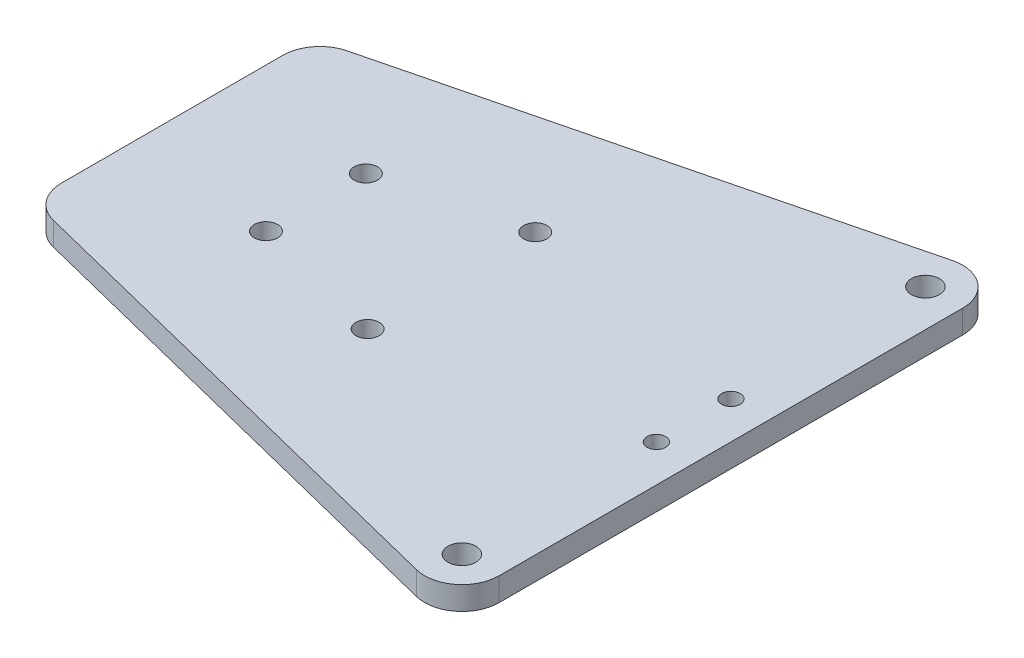
from build123d import *

# Parameters (mm, degrees)
BOSS_EXTRUDE1_DEPTH = 2.5
SKETCH2_R           = 3
SKETCH2_R_2         = 2.5
SKETCH2_R_3         = 2
CUT_EXTRUDE1_DEPTH  = 5


with BuildPart() as part:
    # Sketch1 → Boss-Extrude1 (new, symmetric)
    with BuildSketch(Plane(origin=(0, 0, 0), x_dir=(1, 0, 0), z_dir=(0, 1, 0))):
        with BuildLine():
            Line((-60, -23.753788749), (-60, 23.753788749))
            ThreePointArc((-60, 23.753788749), (-58.305643504, 28.677086424), (-53.940285, 31.51492875))
            Line((-53.940285, 31.51492875), (50.059715, 57.51492875))
            ThreePointArc((50.059715, 57.51492875), (56.923297675, 56.059432253), (60, 49.753788749))
            Line((60, 49.753788749), (60, -49.753788749))
            ThreePointArc((60, -49.753788749), (56.923297675, -56.059432253), (50.059715, -57.51492875))
            Line((50.059715, -57.51492875), (-53.940285, -31.51492875))
            ThreePointArc((-53.940285, -31.51492875), (-58.305643504, -28.677086424), (-60, -23.753788749))
        make_face()
    extrude(amount=BOSS_EXTRUDE1_DEPTH, both=True)

    # Sketch2 → Cut-Extrude1 (cut)
    with BuildSketch(Plane(origin=(0, 2.5, 0), x_dir=(1, 0, 0), z_dir=(0, 1, 0))):
        with Locations(Location((52, 49.753788749, 0), (0, 0, 270))):
            Circle(SKETCH2_R)
        with Locations(Location((0, 18, 0), (0, 0, 270))):
            Circle(SKETCH2_R_2)
        with Locations(Location((52, -49.753788749, 0), (0, 0, 270))):
            Circle(SKETCH2_R)
        with Locations(Location((0, -18, 0), (0, 0, 270))):
            Circle(SKETCH2_R_2)
        with Locations(Location((-29.104275004, 10.723931249, 0), (0, 0, 270))):
            Circle(SKETCH2_R_2)
        with Locations(Location((-29.104275004, -10.723931249, 0), (0, 0, 270))):
            Circle(SKETCH2_R_2)
        with Locations(Location((52, 8, 0), (0, 0, 270))):
            Circle(SKETCH2_R_3)
        with Locations(Location((52, -8, 0), (0, 0, 270))):
            Circle(SKETCH2_R_3)
    extrude(amount=-CUT_EXTRUDE1_DEPTH, mode=Mode.SUBTRACT)


solid = part.part
